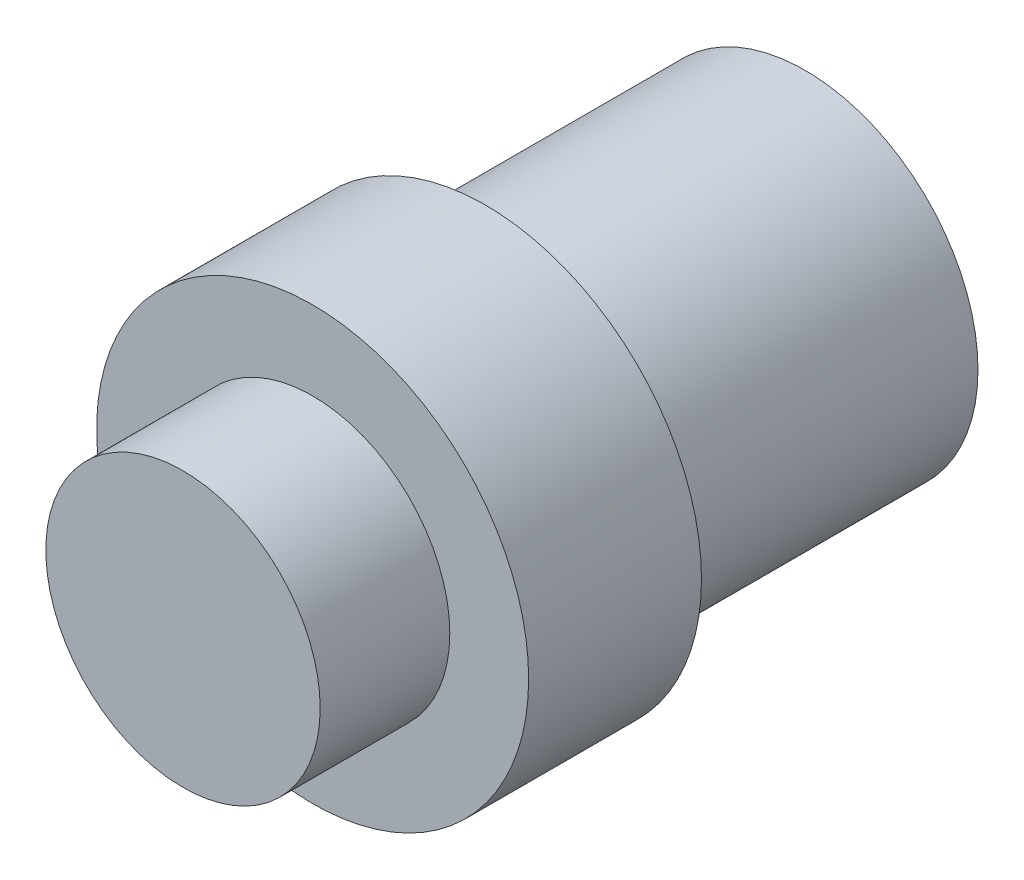
from build123d import *

# Parameters (mm, degrees)
CROQUIS1_R              = 20
SALIENTE_EXTRUIR2_DEPTH = 18.5
CROQUIS3_R              = 25
SALIENTE_EXTRUIR3_DEPTH = 20
CROQUIS4_R              = 15.875
SALIENTE_EXTRUIR4_DEPTH = 15


with BuildPart() as part:
    # Croquis1 → Saliente-Extruir2 (new, symmetric)
    with BuildSketch(Plane.XY):
        Circle(CROQUIS1_R)
    extrude(amount=SALIENTE_EXTRUIR2_DEPTH, both=True)

    # Croquis3 → Saliente-Extruir3 (add)
    with BuildSketch(Plane.XY.offset(18.5)):
        Circle(CROQUIS3_R)
    extrude(amount=SALIENTE_EXTRUIR3_DEPTH)

    # Croquis4 → Saliente-Extruir4 (add)
    with BuildSketch(Plane.XY.offset(38.5)):
        Circle(CROQUIS4_R)
    extrude(amount=SALIENTE_EXTRUIR4_DEPTH)


solid = part.part
